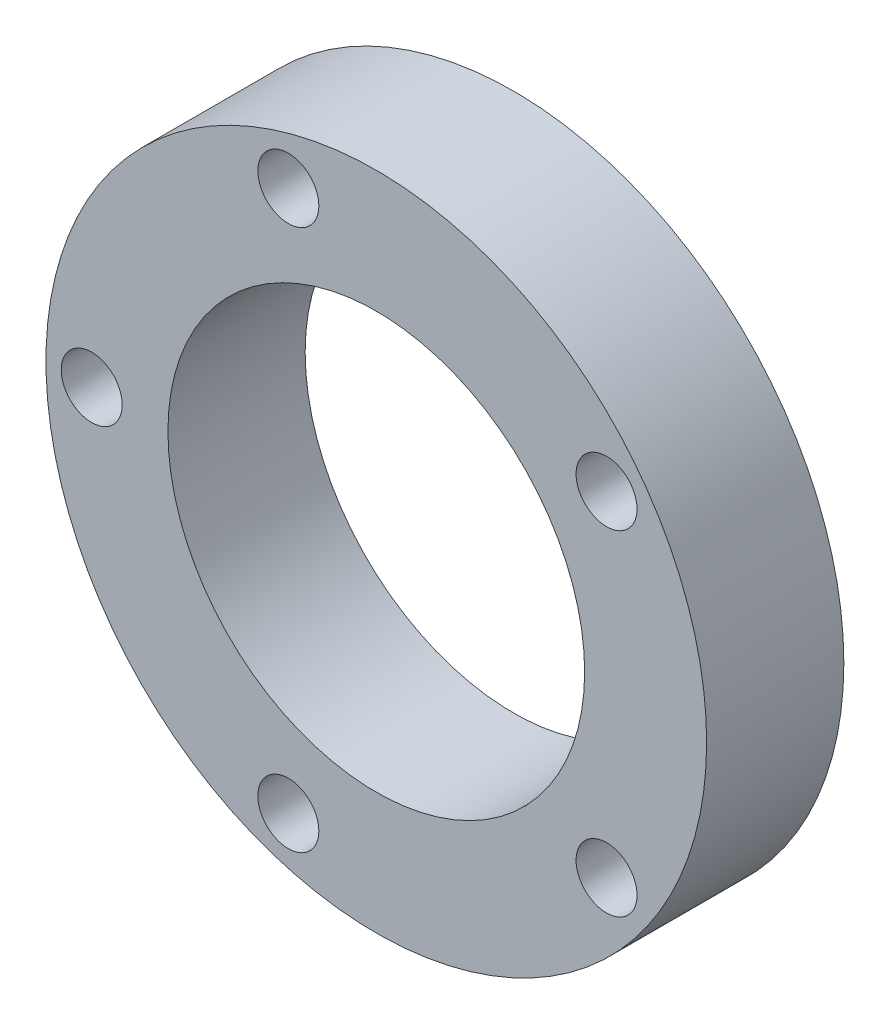
from build123d import *

# Parameters (mm, degrees)
SZKIC1_R                    = 65
DODANIE_WYCI_GNI_CIE1_DEPTH = 27
SZKIC2_R                    = 6
SZKIC2_R_2                  = 41
WYTNIJ_WYCI_GNI_CIE1_DEPTH  = 35


with BuildPart() as part:
    # Szkic1 → Dodanie-wyciągnięcie1 (new body)
    with BuildSketch(Plane.XY):
        Circle(SZKIC1_R)
    extrude(amount=DODANIE_WYCI_GNI_CIE1_DEPTH)

    # Szkic2 → Wytnij-wyciągnięcie1 (cut)
    with BuildSketch(Plane.XY.offset(27)):
        with Locations((-56, 0)):
            Circle(SZKIC2_R)
        with Locations((-17.304951685, 53.259164913)):
            Circle(SZKIC2_R)
        with Locations((45.304951685, 32.915974128)):
            Circle(SZKIC2_R)
        with Locations((45.304951685, -32.915974128)):
            Circle(SZKIC2_R)
        with Locations((-17.304951685, -53.259164913)):
            Circle(SZKIC2_R)
        Circle(SZKIC2_R_2)
    extrude(amount=-WYTNIJ_WYCI_GNI_CIE1_DEPTH, mode=Mode.SUBTRACT)


solid = part.part
